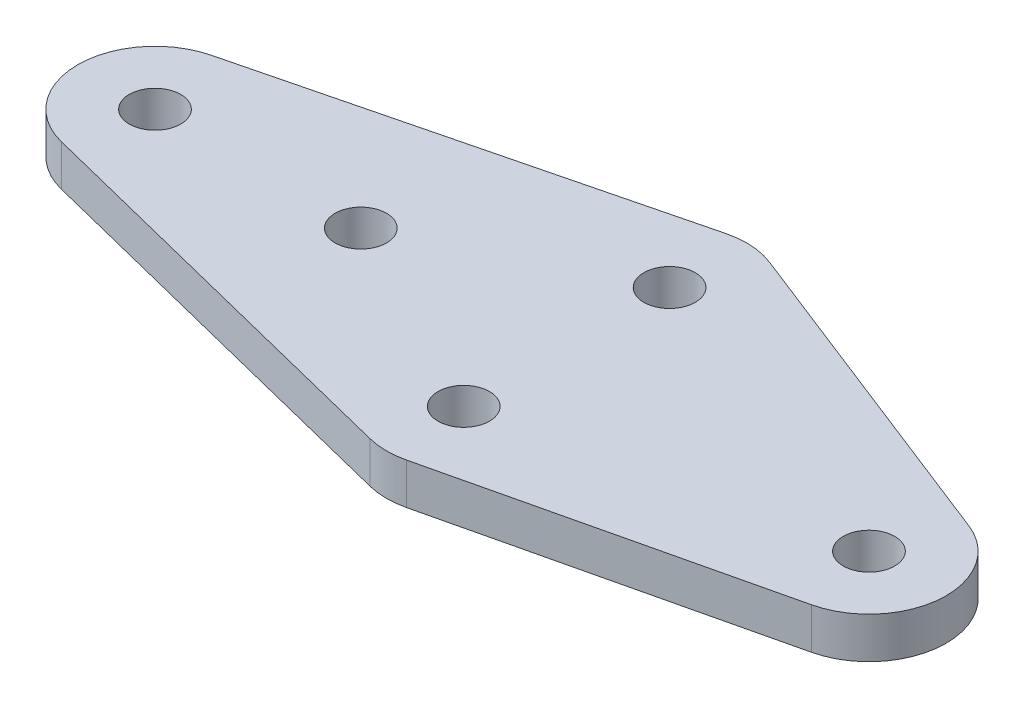
from build123d import *

# Parameters (mm, degrees)
SKETCH1_R           = 2.5
BOSS_EXTRUDE1_DEPTH = 4


with BuildPart() as part:
    # Sketch1 → Boss-Extrude1 (new body)
    with BuildSketch(Plane(origin=(0, 0, 0), x_dir=(1, 0, 0), z_dir=(0, 1, 0))):
        with BuildLine():
            Line((-37.756574527, 7.276068751), (2.243425473, 17.276068751))
            ThreePointArc((2.243425473, 17.276068751), (4.544910282, 17.484465578), (6.800590588, 16.982302337))
            Line((6.800590588, 16.982302337), (38.675705267, 4.482302337))
            ThreePointArc((38.675705267, 4.482302337), (43.41849203, -3.034430686), (37.655346486, -9.80063014))
            Line((37.655346486, -9.80063014), (5.780231807, -17.30063014))
            ThreePointArc((5.780231807, -17.30063014), (4.010360086, -17.499819158), (2.243425473, -17.276068751))
            Line((2.243425473, -17.276068751), (-37.756574527, -7.276068751))
            ThreePointArc((-37.756574527, -7.276068751), (-43.43755734, 0), (-37.756574527, 7.276068751))
        make_face()
        with Locations(Location((35.937557339, -2.5, 0), (0, 0, 270))):
            Circle(SKETCH1_R, mode=Mode.SUBTRACT)
        with Locations(Location((4.06244266, 10, 0), (0, 0, 270))):
            Circle(SKETCH1_R, mode=Mode.SUBTRACT)
        with Locations(Location((4.06244266, -10, 0), (0, 0, 90))):
            Circle(SKETCH1_R, mode=Mode.SUBTRACT)
        with Locations(Location((-15.93755734, 0, 0), (0, 0, 90))):
            Circle(SKETCH1_R, mode=Mode.SUBTRACT)
        with Locations(Location((-35.93755734, 0, 0), (0, 0, 90))):
            Circle(SKETCH1_R, mode=Mode.SUBTRACT)
    extrude(amount=BOSS_EXTRUDE1_DEPTH)


solid = part.part
